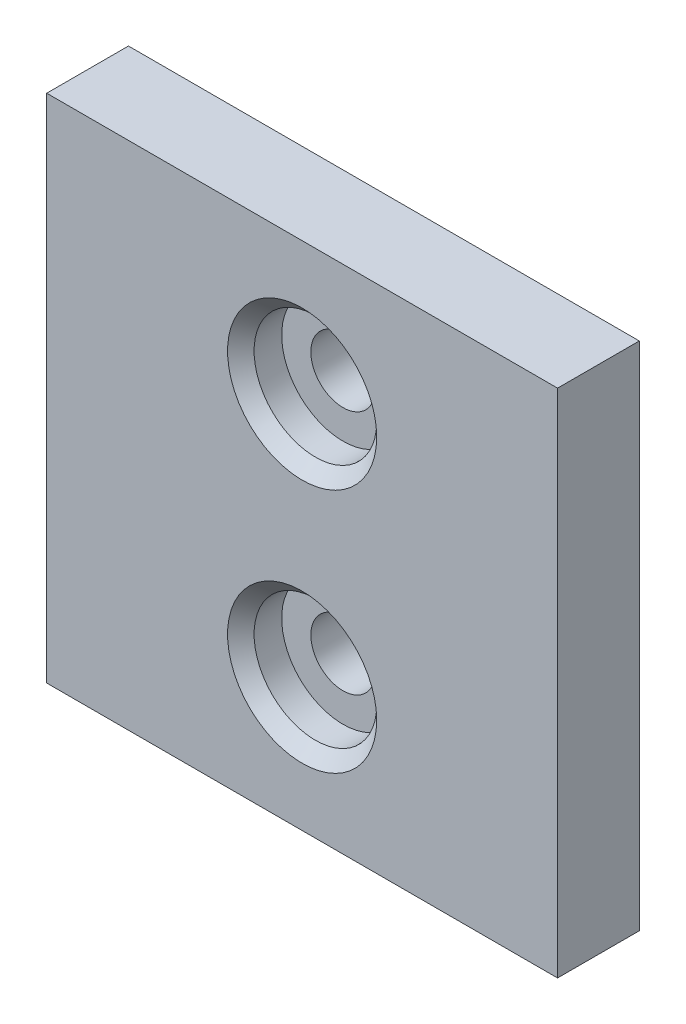
from build123d import *

# Parameters (mm, degrees)
SKETCH1_W                              = 50
SKETCH1_H                              = 50
BOSS_EXTRUDE1_DEPTH                    = 8
CBORE_FOR_M6_HEX_HEAD_BOLT2_AT_2_COUNT = 2
CBORE_FOR_M6_HEX_HEAD_BOLT2_AT_2_PITCH = 24


with BuildPart() as part:
    # Sketch1 → Boss-Extrude1 (new body)
    with BuildSketch(Plane.XY):
        Rectangle(SKETCH1_W, SKETCH1_H)
    extrude(amount=BOSS_EXTRUDE1_DEPTH)

    # Sketch14 → CBORE for M6 Hex Head Bolt2 (revolve, cut)
    with BuildSketch(Plane(origin=(0, -12, 8), x_dir=(0, -1, 0), z_dir=(1, 0, 0))):
        Polygon((0, 0), (0, 8), (3.15, 8), (3.15, 4), (6, 4), (6, 1.2985), (7.2985, 0), align=None)
    cbore_for_m6_hex_head_bolt2 = revolve(axis=Axis((0, -12, 14.35), (0, 0, -1)), mode=Mode.SUBTRACT)

    # CBORE for M6 Hex Head Bolt2 at 2: CBORE for M6 Hex Head Bolt2 ×2
    with Locations(*[(0, i * CBORE_FOR_M6_HEX_HEAD_BOLT2_AT_2_PITCH, 0) for i in range(1, CBORE_FOR_M6_HEX_HEAD_BOLT2_AT_2_COUNT)]):
        add(cbore_for_m6_hex_head_bolt2, mode=Mode.SUBTRACT)


solid = part.part
